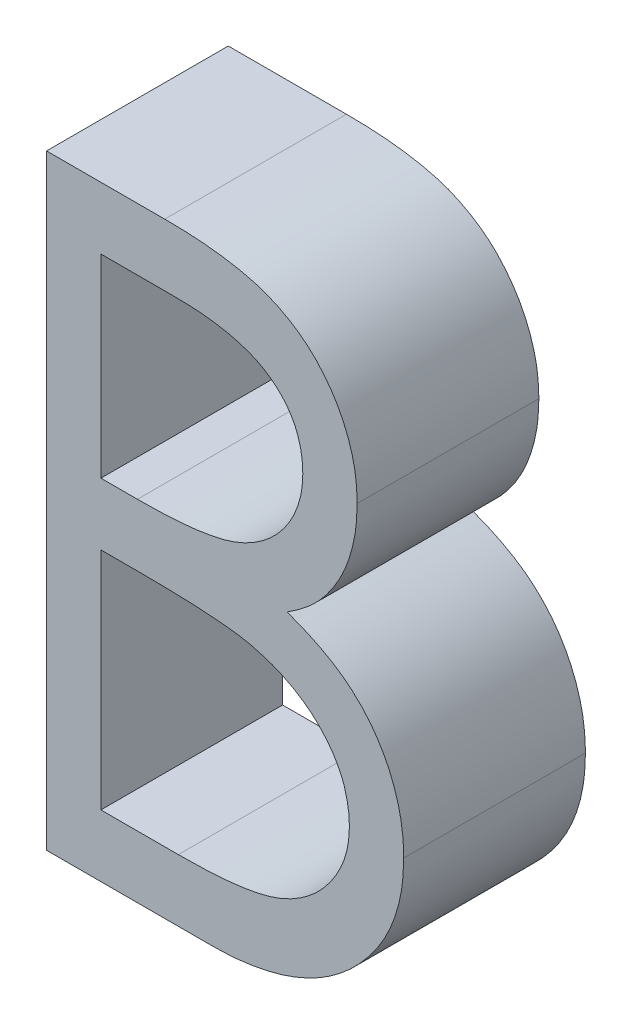
from build123d import *

# Parameters (mm, degrees)
BOSS_EXTRU_1_DEPTH = 1.5


with BuildPart() as part:
    # Esquisse1 → Boss.-Extru.1 (new body)
    with BuildSketch(Plane.XY):
        with BuildLine():
            Line((-55.432465326, -17.870119076), (-54.456904428, -17.870119076))
            add(Edge.make_bspline(
                [(-54.456904428, -17.870119076), (-54.40914946, -17.870370148), (-54.316588445, -17.870856788), (-54.181989242, -17.878404118), (-54.055919513, -17.888695075), (-53.938342695, -17.905023779), (-53.82931312, -17.924726318), (-53.72850221, -17.948586055), (-53.636230535, -17.977195503), (-53.526069483, -18.022690191), (-53.400468539, -18.090294717), (-53.264470835, -18.190192667), (-53.148179065, -18.3123819), (-53.047912897, -18.450214265), (-52.968197012, -18.601836796), (-52.910526587, -18.763635637), (-52.874015337, -18.93352384), (-52.870260431, -19.050156951), (-52.868362762, -19.109101448)],
                knots=[0, 0, 0, 0, 1.001505555, 1.941167018, 2.826882275, 3.653841531, 4.429895133, 5.150066043, 5.825578002, 6.45369114, 7.647487171, 8.808567382, 9.977351308, 11.170798116, 12.373658725, 13.556498008, 14.765093433, 16, 16, 16, 16], degree=3))
            add(Edge.make_bspline(
                [(-52.868362762, -19.109101448), (-52.869924502, -19.164319385), (-52.87299347, -19.272827838), (-52.902340269, -19.431533708), (-52.948284081, -19.582606878), (-53.012148723, -19.725496), (-53.095151574, -19.85697259), (-53.193520601, -19.978097256), (-53.312201748, -20.083741623), (-53.401120662, -20.142802912), (-53.446287441, -20.172803371)],
                knots=[0, 0, 0, 0, 1.044552857, 2.05264487, 3.044412934, 4.028983338, 5.005914585, 5.980388656, 6.974128949, 8, 8, 8, 8], degree=3))
            add(Edge.make_bspline(
                [(-53.446287441, -20.172803371), (-53.38948683, -20.194610512), (-53.280813191, -20.236332976), (-53.131261745, -20.310097924), (-53.002411966, -20.390329511), (-52.893273186, -20.477946439), (-52.799933679, -20.572387598), (-52.718429477, -20.675037761), (-52.648884657, -20.787235987), (-52.589294766, -20.907812466), (-52.542796543, -21.035535992), (-52.507973823, -21.169208529), (-52.488020324, -21.308350751), (-52.485180836, -21.40304415), (-52.483747377, -21.450848243)],
                knots=[0, 0, 0, 0, 1.27268992, 2.434971085, 3.483601985, 4.442670788, 5.356604649, 6.2567628, 7.179492994, 8.113709626, 9.066344395, 10.018646069, 10.999752585, 12, 12, 12, 12], degree=3))
            add(Edge.make_bspline(
                [(-52.483747377, -21.450848243), (-52.485142871, -21.49965806), (-52.487888546, -21.595692743), (-52.508145648, -21.736771507), (-52.542444372, -21.871592859), (-52.589688867, -22.001028834), (-52.651349317, -22.124829027), (-52.726389266, -22.243133689), (-52.815862928, -22.354754162), (-52.915952741, -22.460930766), (-53.029184377, -22.556399034), (-53.151349741, -22.641421472), (-53.283987341, -22.711344418), (-53.424918761, -22.770081591), (-53.575724927, -22.814949018), (-53.735728652, -22.846338409), (-53.90479194, -22.867488462), (-54.02080587, -22.869227326), (-54.080301864, -22.870119076)],
                knots=[0, 0, 0, 0, 0.978564426, 1.925352924, 2.850884081, 3.763762016, 4.682927383, 5.618979971, 6.567305752, 7.547517671, 8.540179244, 9.531824382, 10.526200242, 11.540722885, 12.589160233, 13.674978461, 14.80764778, 16, 16, 16, 16], degree=3))
            Line((-54.080301864, -22.870119076), (-55.432465326, -22.870119076))
            Line((-55.432465326, -22.870119076), (-55.432465326, -17.870119076))
        make_face()
        with BuildLine():
            Line((-54.983747377, -18.382939589), (-54.983747377, -19.985503692))
            Line((-54.983747377, -19.985503692), (-54.682265005, -19.985503692))
            add(Edge.make_bspline(
                [(-54.682265005, -19.985503692), (-54.638195298, -19.984932373), (-54.553043642, -19.983828469), (-54.429729504, -19.980666302), (-54.315265192, -19.971811954), (-54.209848288, -19.962960151), (-54.113644796, -19.948567883), (-54.026867851, -19.931436279), (-53.94815557, -19.913317843), (-53.857384791, -19.88250429), (-53.754423436, -19.836964754), (-53.644661858, -19.766290703), (-53.54789833, -19.682113055), (-53.466188062, -19.58498311), (-53.399314533, -19.478031416), (-53.352866368, -19.362964444), (-53.321370248, -19.24264997), (-53.318525203, -19.160052466), (-53.31708071, -19.118115871)],
                knots=[0, 0, 0, 0, 1.156816544, 2.235205308, 3.236616184, 4.169592532, 5.011045266, 5.787822928, 6.49130361, 7.128639758, 8.301311294, 9.436451833, 10.541879658, 11.654887649, 12.756523258, 13.837046038, 14.901820046, 16, 16, 16, 16], degree=3))
            add(Edge.make_bspline(
                [(-53.31708071, -19.118115871), (-53.317832396, -19.090364769), (-53.319306911, -19.035927952), (-53.331383057, -18.956571731), (-53.351908164, -18.881937799), (-53.37827144, -18.811003356), (-53.415112423, -18.745986427), (-53.4584888, -18.684639005), (-53.510896929, -18.629050264), (-53.570550232, -18.577093838), (-53.639133979, -18.531030227), (-53.716607253, -18.490686279), (-53.804018221, -18.458199455), (-53.899893728, -18.429747809), (-54.005709567, -18.409764532), (-54.120244643, -18.393116835), (-54.244437099, -18.38464149), (-54.330358674, -18.383519543), (-54.374773018, -18.382939589)],
                knots=[0, 0, 0, 0, 0.91205012, 1.789085906, 2.630437955, 3.453916878, 4.269457761, 5.079663411, 5.91843418, 6.774407191, 7.675494373, 8.627863946, 9.638891023, 10.736472738, 11.911756761, 13.175263542, 14.539845004, 16, 16, 16, 16], degree=3))
            Line((-54.374773018, -18.382939589), (-54.983747377, -18.382939589))
        make_face(mode=Mode.SUBTRACT)
        with BuildLine():
            Line((-54.983747377, -20.498324204), (-54.983747377, -22.357298563))
            Line((-54.983747377, -22.357298563), (-54.344724941, -22.357298563))
            add(Edge.make_bspline(
                [(-54.344724941, -22.357298563), (-54.298983619, -22.356750353), (-54.210823249, -22.355693749), (-54.083535778, -22.352244386), (-53.965559915, -22.344398277), (-53.857434007, -22.332047064), (-53.757990503, -22.318649279), (-53.668422356, -22.300633164), (-53.588003508, -22.279991791), (-53.494754497, -22.248085831), (-53.389749485, -22.198519444), (-53.276591119, -22.123784835), (-53.175982236, -22.034751538), (-53.090546151, -21.931707375), (-53.020527596, -21.819662622), (-52.969591232, -21.700883551), (-52.938175722, -21.577332797), (-52.934372623, -21.493094637), (-52.932465326, -21.450848243)],
                knots=[0, 0, 0, 0, 1.160039823, 2.235823828, 3.228722157, 4.157150951, 4.99529583, 5.772374946, 6.472645482, 7.099169577, 8.269452708, 9.405989375, 10.527446681, 11.663510218, 12.788923519, 13.866172445, 14.929861265, 16, 16, 16, 16], degree=3))
            add(Edge.make_bspline(
                [(-52.932465326, -21.450848243), (-52.932859761, -21.424429185), (-52.933642268, -21.372017211), (-52.945443146, -21.294994612), (-52.962605818, -21.220386222), (-52.98479358, -21.14798945), (-53.017107105, -21.079113198), (-53.05483074, -21.012395256), (-53.099061314, -20.947747428), (-53.167981551, -20.866015637), (-53.268227243, -20.771848476), (-53.410665494, -20.679652044), (-53.57262592, -20.605298034), (-53.690093767, -20.573727353), (-53.750774621, -20.557418756)],
                knots=[0, 0, 0, 0, 0.723448775, 1.435228256, 2.130040452, 2.821711965, 3.505591119, 4.210454504, 4.921174351, 5.648778258, 7.137944449, 8.670945889, 10.280296675, 12, 12, 12, 12], degree=3))
            add(Edge.make_bspline(
                [(-53.750774621, -20.557418756), (-53.775101901, -20.552482921), (-53.827848461, -20.541781015), (-53.91385929, -20.530484296), (-54.012053389, -20.520419924), (-54.122657499, -20.512975413), (-54.245811558, -20.505280351), (-54.381778584, -20.50228775), (-54.53000332, -20.498717378), (-54.632849566, -20.498458615), (-54.686271416, -20.498324204)],
                knots=[0, 0, 0, 0, 0.634451884, 1.375622551, 2.216452059, 3.157844607, 4.20941857, 5.370758133, 6.634282058, 8, 8, 8, 8], degree=3))
            Line((-54.686271416, -20.498324204), (-54.983747377, -20.498324204))
        make_face(mode=Mode.SUBTRACT)
    extrude(amount=BOSS_EXTRU_1_DEPTH)


solid = part.part
